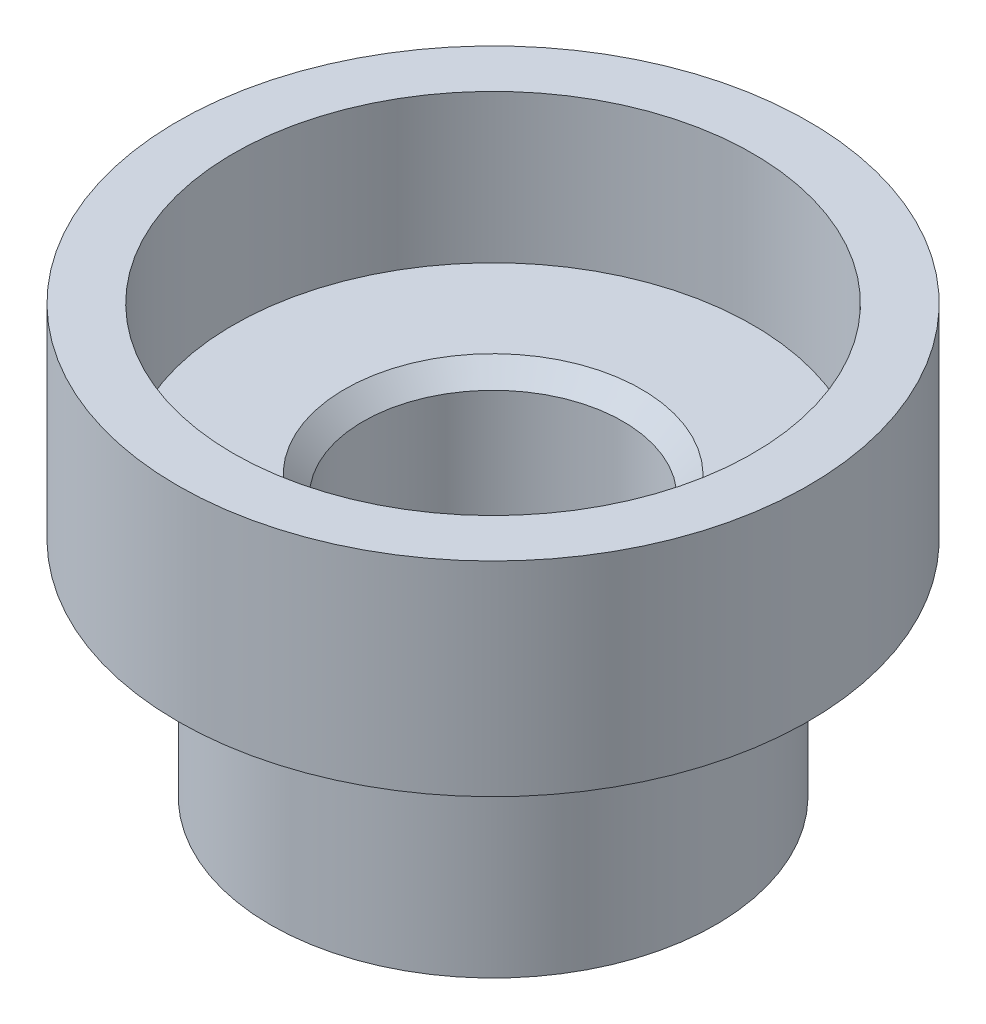
from build123d import *


with BuildPart() as part:
    # Sketch1 → Revolve1 (revolve)
    with BuildSketch(Plane(origin=(0, 0, 0), x_dir=(-1, 0, 0), z_dir=(0, 0, -1)), mode=Mode.PRIVATE) as revolve1_sk:
        with BuildLine():
            Line((-2.4, -4.6), (-1.4, -4.6))
            Line((-1.4, -4.6), (-1.4, -1.8))
            Line((-1.4, -1.8), (-1.6, -1.6))
            Line((-1.6, -1.6), (-2.8, -1.6))
            Line((-2.8, -1.6), (-2.8, 0))
            Line((-2.8, 0), (-3.4, 0))
            Line((-3.4, 0), (-3.4, -2.2))
            Line((-3.4, -2.2), (-2.6, -2.2))
            ThreePointArc((-2.6, -2.2), (-2.458578644, -2.258578644), (-2.4, -2.4))
            Line((-2.4, -2.4), (-2.4, -4.6))
        make_face()
    revolve(revolve1_sk.sketch.rotate(Axis((0, -4.6, 0), (0, 1, 0)), 270), axis=Axis((0, -4.6, 0), (0, 1, 0)))


solid = part.part
